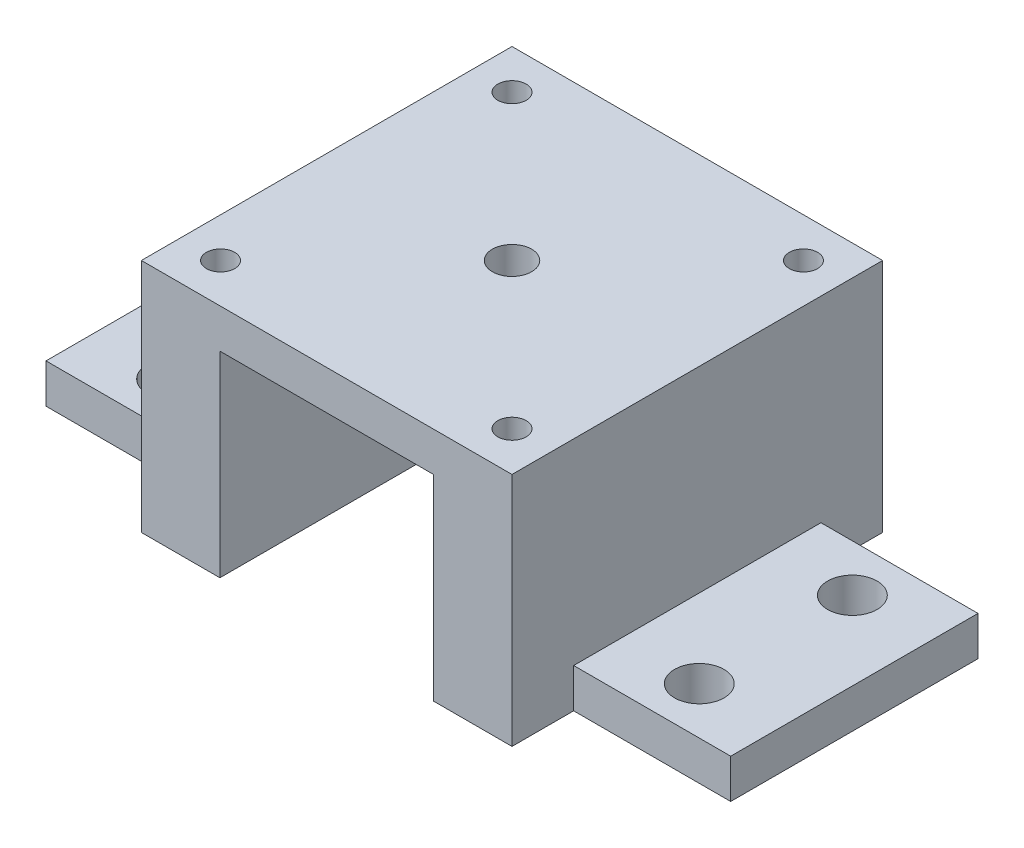
from build123d import *

# Parameters (mm, degrees)
SKETCH1_W           = 59.944
SKETCH1_H           = 59.944
BOSS_EXTRUDE1_DEPTH = 38.1
SKETCH2_W           = 34.544
SKETCH2_H           = 31.75
CUT_EXTRUDE1_DEPTH  = 93.941789697
SKETCH3_R           = 3.175
CUT_EXTRUDE2_DEPTH  = 80.152691578
SKETCH4_W           = 40
SKETCH4_H           = 6.35
BOSS_EXTRUDE2_DEPTH = 25.4
SKETCH5_W           = 40
SKETCH5_H           = 6.35
BOSS_EXTRUDE3_DEPTH = 25.4
SKETCH6_R           = 4
CUT_EXTRUDE3_DEPTH  = 98.529053538
SKETCH7_R           = 2.286
CUT_EXTRUDE4_DEPTH  = 12.7


with BuildPart() as part:
    # Sketch1 → Boss-Extrude1 (new body)
    with BuildSketch(Plane(origin=(0, 0, 0), x_dir=(1, 0, 0), z_dir=(0, 1, 0))):
        with Locations((-29.972, -4.96015493)):
            Rectangle(SKETCH1_W, SKETCH1_H)
    extrude(amount=BOSS_EXTRUDE1_DEPTH)

    # Sketch2 → Cut-Extrude1 (cut, through all)
    with BuildSketch(Plane.XY.offset(34.93215493)):
        with Locations((-29.972, 15.875)):
            Rectangle(SKETCH2_W, SKETCH2_H)
    extrude(amount=-CUT_EXTRUDE1_DEPTH, mode=Mode.SUBTRACT)

    # Sketch3 → Cut-Extrude2 (cut, through all)
    with BuildSketch(Plane(origin=(0, 38.1, 0), x_dir=(1, 0, 0), z_dir=(0, 1, 0))):
        with Locations(Location((-29.972, -4.96015493, 0), (0, 0, 270))):
            Circle(SKETCH3_R)
    extrude(amount=-CUT_EXTRUDE2_DEPTH, mode=Mode.SUBTRACT)

    # Sketch4 → Boss-Extrude2 (add)
    with BuildSketch(Plane(origin=(0, 0, 0), x_dir=(0, 0, -1), z_dir=(1, 0, 0))):
        with Locations((-4.960154808, 3.175)):
            Rectangle(SKETCH4_W, SKETCH4_H)
    extrude(amount=BOSS_EXTRUDE2_DEPTH)

    # Sketch5 → Boss-Extrude3 (add)
    with BuildSketch(Plane.ZY.offset(59.944)):
        with Locations((4.960154808, 3.175)):
            Rectangle(SKETCH5_W, SKETCH5_H)
    extrude(amount=BOSS_EXTRUDE3_DEPTH)

    # Sketch6 → Cut-Extrude3 (cut, through all)
    with BuildSketch(Plane(origin=(0, 6.35, 0), x_dir=(1, 0, 0), z_dir=(0, 1, 0))):
        with Locations(Location((-72.644, 7.419845192, 0), (0, 0, 270))):
            Circle(SKETCH6_R)
        with Locations(Location((-72.644, -17.340154808, 0), (0, 0, 270))):
            Circle(SKETCH6_R)
        with Locations(Location((12.7, 7.419845192, 0), (0, 0, 270))):
            Circle(SKETCH6_R)
        with Locations(Location((12.7, -17.340154808, 0), (0, 0, 270))):
            Circle(SKETCH6_R)
    extrude(amount=-CUT_EXTRUDE3_DEPTH, mode=Mode.SUBTRACT)

    # Sketch7 → Cut-Extrude4 (cut)
    with BuildSketch(Plane(origin=(0, 38.1, 0), x_dir=(1, 0, 0), z_dir=(0, 1, 0))):
        with Locations(Location((-53.5432, 18.61104507, 0), (0, 0, 270))):
            Circle(SKETCH7_R)
        with Locations(Location((-6.4008, -28.53135493, 0), (0, 0, 270))):
            Circle(SKETCH7_R)
        with Locations(Location((-53.5432, -28.53135493, 0), (0, 0, 270))):
            Circle(SKETCH7_R)
        with Locations(Location((-6.4008, 18.61104507, 0), (0, 0, 270))):
            Circle(SKETCH7_R)
    extrude(amount=-CUT_EXTRUDE4_DEPTH, mode=Mode.SUBTRACT)


solid = part.part
